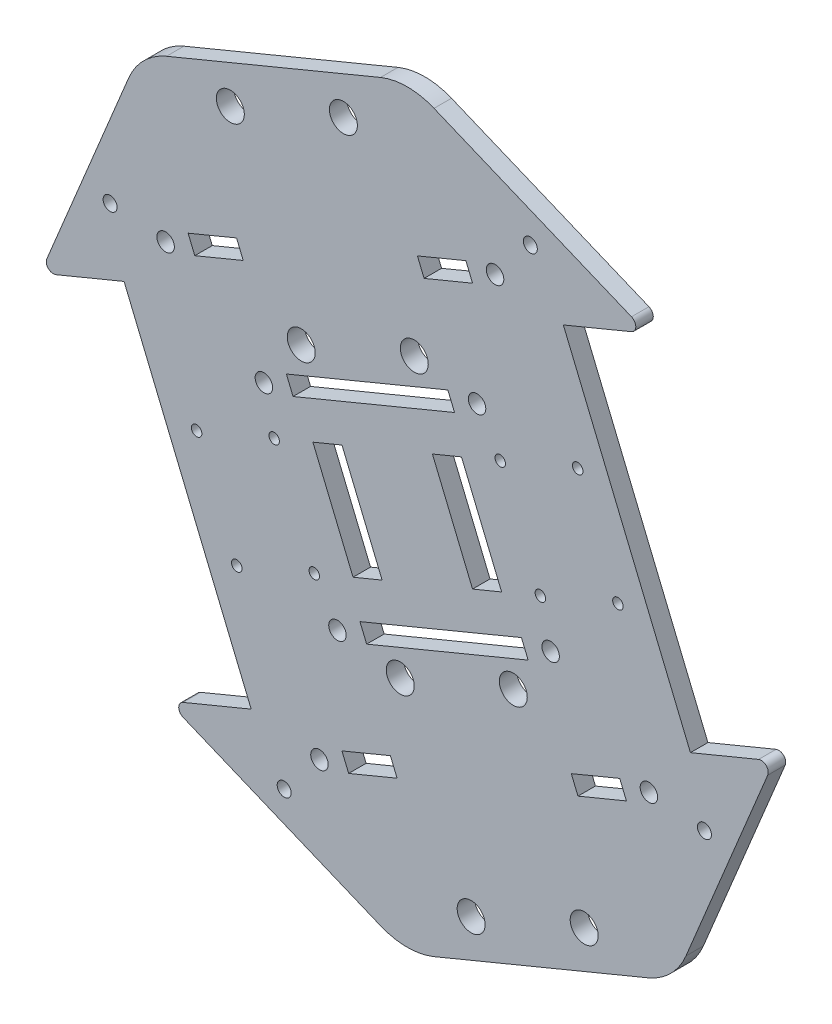
from build123d import *

# Parameters (mm, degrees)
SKETCH_1_R      = 2
SKETCH_1_R_2    = 2.5
SKETCH_1_R_3    = 1.5
SKETCH_1_R_4    = 4
EXTRUDE_1_DEPTH = 5
FILLET_1_R      = 2
FILLET_2_R      = 20


with BuildPart() as part:
    # 草图1 → 凸台-拉伸1 (new body)
    with BuildSketch(Plane.XY):
        Polygon((68.594555656, 79.826424772), (0, 108.239220029), (-76.536686473, 76.536686473), (-104.949481731, 7.942130817), (-81.001271248, 17.861804393), (-44.646345173, -69.906751195), (-68.594555656, -79.826424772), (0, -108.239220029), (76.536686473, -76.536686473), (104.949481731, -7.942130817), (81.001271248, -17.861804393), (44.646345173, 69.906751195), align=None)
        with Locations((-35.206875778, -84.996916991)):
            Circle(SKETCH_1_R, mode=Mode.SUBTRACT)
        with Locations((-25.113558797, -72.63992817)):
            Circle(SKETCH_1_R_2, mode=Mode.SUBTRACT)
        Polygon((-16.765813956, -71.888159542), (-18.679231118, -67.26876188), (-4.82103813, -61.528510394), (-2.907620968, -66.147908057), align=None, mode=Mode.SUBTRACT)
        with Locations((-60.249143904, -8.720129522)):
            Circle(SKETCH_1_R_3, mode=Mode.SUBTRACT)
        with Locations((-48.768640933, -36.436515497)):
            Circle(SKETCH_1_R_3, mode=Mode.SUBTRACT)
        with Locations((-2.008604821, -40.880502769)):
            Circle(SKETCH_1_R_4, mode=Mode.SUBTRACT)
        with Locations((-19.964230183, -38.035240412)):
            Circle(SKETCH_1_R_2, mode=Mode.SUBTRACT)
        with Locations((-26.595532152, -27.25211312)):
            Circle(SKETCH_1_R_3, mode=Mode.SUBTRACT)
        Polygon((-15.508977762, -22.659911932), (-26.989480733, 5.056474043), (-18.674564941, 8.500624935), (-7.19406197, -19.215761041), align=None, mode=Mode.SUBTRACT)
        with Locations((18.273617094, -89.846117992)):
            Circle(SKETCH_1_R_4, mode=Mode.SUBTRACT)
        with Locations((50.609400732, -76.45219786)):
            Circle(SKETCH_1_R_4, mode=Mode.SUBTRACT)
        with Locations((30.327178816, -27.486582637)):
            Circle(SKETCH_1_R_4, mode=Mode.SUBTRACT)
        Polygon((48.829632852, -44.717635844), (46.91621569, -40.098238182), (60.774408678, -34.357986696), (62.68782584, -38.977384359), align=None, mode=Mode.SUBTRACT)
        Polygon((-11.616485342, -37.283471784), (-13.529902504, -32.664074122), (32.664074122, -13.529902504), (34.577491284, -18.149300166), align=None, mode=Mode.SUBTRACT)
        with Locations((41.011818963, -12.778133876)):
            Circle(SKETCH_1_R_2, mode=Mode.SUBTRACT)
        with Locations((38.076035123, -0.464272855)):
            Circle(SKETCH_1_R_3, mode=Mode.SUBTRACT)
        with Locations((69.122153519, -33.606218069)):
            Circle(SKETCH_1_R_2, mode=Mode.SUBTRACT)
        with Locations((84.996916991, -35.206875778)):
            Circle(SKETCH_1_R, mode=Mode.SUBTRACT)
        with Locations((-84.996916991, 35.206875778)):
            Circle(SKETCH_1_R, mode=Mode.SUBTRACT)
        with Locations((-69.122153519, 33.606218069)):
            Circle(SKETCH_1_R_2, mode=Mode.SUBTRACT)
        with Locations((-38.076035123, 0.464272855)):
            Circle(SKETCH_1_R_3, mode=Mode.SUBTRACT)
        with Locations((-41.011818963, 12.778133876)):
            Circle(SKETCH_1_R_2, mode=Mode.SUBTRACT)
        Polygon((13.529902504, 32.664074122), (-32.664074122, 13.529902504), (-34.577491284, 18.149300166), (11.616485342, 37.283471784), align=None, mode=Mode.SUBTRACT)
        Polygon((-46.91621569, 40.098238182), (-60.774408678, 34.357986696), (-62.68782584, 38.977384359), (-48.829632852, 44.717635844), align=None, mode=Mode.SUBTRACT)
        with Locations((-30.327178816, 27.486582637)):
            Circle(SKETCH_1_R_4, mode=Mode.SUBTRACT)
        with Locations((-50.609400732, 76.45219786)):
            Circle(SKETCH_1_R_4, mode=Mode.SUBTRACT)
        with Locations((-18.273617094, 89.846117992)):
            Circle(SKETCH_1_R_4, mode=Mode.SUBTRACT)
        Polygon((18.674564941, -8.500624935), (7.19406197, 19.215761041), (15.508977762, 22.659911932), (26.989480733, -5.056474043), align=None, mode=Mode.SUBTRACT)
        with Locations((26.595532152, 27.25211312)):
            Circle(SKETCH_1_R_3, mode=Mode.SUBTRACT)
        with Locations((19.964230183, 38.035240412)):
            Circle(SKETCH_1_R_2, mode=Mode.SUBTRACT)
        with Locations((2.008604821, 40.880502769)):
            Circle(SKETCH_1_R_4, mode=Mode.SUBTRACT)
        with Locations((48.768640933, 36.436515497)):
            Circle(SKETCH_1_R_3, mode=Mode.SUBTRACT)
        with Locations((60.249143904, 8.720129522)):
            Circle(SKETCH_1_R_3, mode=Mode.SUBTRACT)
        Polygon((4.82103813, 61.528510394), (2.907620968, 66.147908057), (16.765813956, 71.888159542), (18.679231118, 67.26876188), align=None, mode=Mode.SUBTRACT)
        with Locations((25.113558797, 72.63992817)):
            Circle(SKETCH_1_R_2, mode=Mode.SUBTRACT)
        with Locations((35.206875778, 84.996916991)):
            Circle(SKETCH_1_R, mode=Mode.SUBTRACT)
    extrude(amount=EXTRUDE_1_DEPTH)

    # 圆角1
    fillet_1_edges = [part.edges().sort_by_distance(p)[0] for p in [
        (104.949481731, -7.942130817, 2.5),
        (-68.594555656, -79.826424772, 2.5),
        (-104.949481731, 7.942130817, 2.5),
        (68.594555656, 79.826424772, 2.5),
    ]]
    fillet(fillet_1_edges, radius=FILLET_1_R)

    # 圆角2
    fillet_2_edges = [part.edges().sort_by_distance(p)[0] for p in [
        (76.536686473, -76.536686473, 2.5),
        (0, -108.239220029, 2.5),
        (-76.536686473, 76.536686473, 2.5),
        (0, 108.239220029, 2.5),
    ]]
    fillet(fillet_2_edges, radius=FILLET_2_R)


solid = part.part
